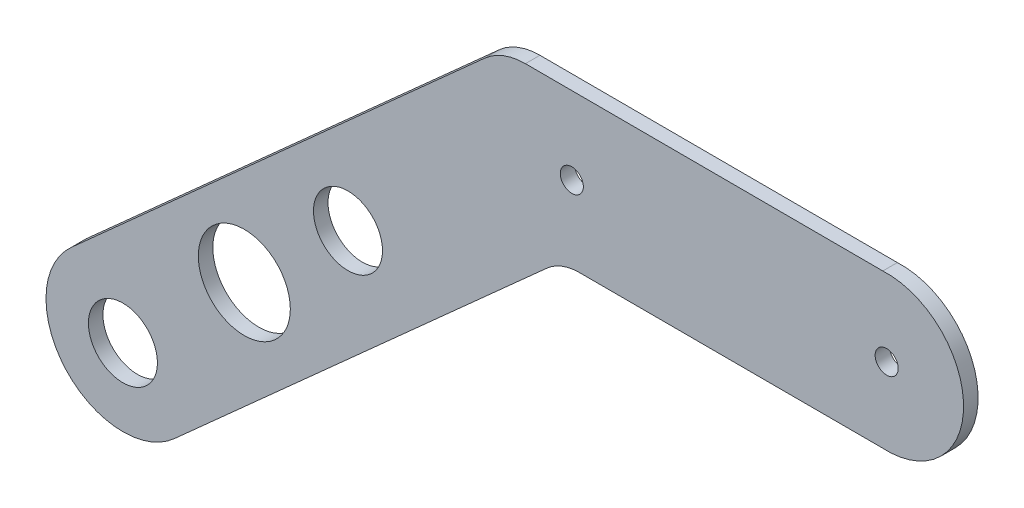
from build123d import *

# Parameters (mm, degrees)
CROQUIS1_R              = 14.25
CROQUIS1_R_2            = 4.7625
CROQUIS1_R_3            = 19
SALIENTE_EXTRUIR1_DEPTH = 6
REDONDEO1_R             = 25
REDONDEO2_R             = 19.999999878


with BuildPart() as part:
    # Croquis1 → Saliente-Extruir1 (new body)
    with BuildSketch(Plane.XY):
        with BuildLine():
            Line((41.52932014, 201.930330406), (198.68793394, 201.566461221))
            ThreePointArc((198.68793394, 201.566461221), (232.028588704, 169.640855787), (198.25760714, 138.170801026))
            Line((198.25760714, 138.170801026), (65.750390297, 138.369874115))
            Line((65.750390297, 138.369874115), (-93.627365444, -4.467720371))
            ThreePointArc((-93.627365444, -4.467720371), (-138.59478698, -2.355669211), (-136.250697374, 42.600253688))
            Line((-136.250697374, 42.600253688), (41.52932014, 201.930330406))
        make_face()
        with Locations((-115.060486547, 18.956280563)):
            Circle(CROQUIS1_R, mode=Mode.SUBTRACT)
        with Locations((-22.130431971, 105.518425617)):
            Circle(CROQUIS1_R, mode=Mode.SUBTRACT)
        with Locations((200.27932014, 169.856368349)):
            Circle(CROQUIS1_R_2, mode=Mode.SUBTRACT)
        with Locations((70.27932014, 169.856368349)):
            Circle(CROQUIS1_R_2, mode=Mode.SUBTRACT)
        with Locations((-64.936795693, 65.645311557)):
            Circle(CROQUIS1_R_3, mode=Mode.SUBTRACT)
    extrude(amount=SALIENTE_EXTRUIR1_DEPTH)

    # Redondeo1
    redondeo1_edges = [part.edges().sort_by_distance(p)[0] for p in [
        (41.52932014, 201.930330406, 3),
    ]]
    fillet(redondeo1_edges, radius=REDONDEO1_R)

    # Redondeo2
    redondeo2_edges = [part.edges().sort_by_distance(p)[0] for p in [
        (65.750390297, 138.369874115, 3),
    ]]
    fillet(redondeo2_edges, radius=REDONDEO2_R)


solid = part.part
